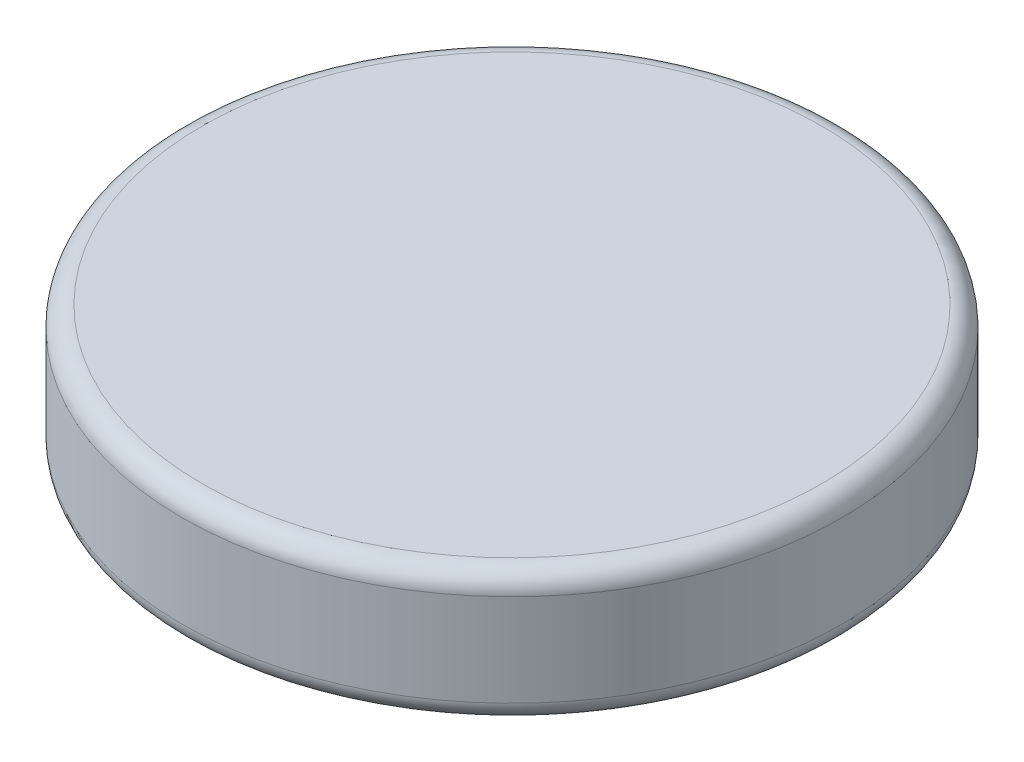
from build123d import *

# Parameters (mm, degrees)
SCHIZZO1_R                   = 5
ESTRUSIONE_ESTRUSIONE1_DEPTH = 2
RACCORDO1_R                  = 0.3
RACCORDO2_R                  = 0.3


with BuildPart() as part:
    # Schizzo1 → Estrusione-Estrusione1 (new body)
    with BuildSketch(Plane(origin=(0, 0, 0), x_dir=(1, 0, 0), z_dir=(0, 1, 0))):
        with Locations(Location((0, 0, 0), (0, 0, 270))):
            Circle(SCHIZZO1_R)
    extrude(amount=ESTRUSIONE_ESTRUSIONE1_DEPTH)

    # Raccordo1
    raccordo1_edges = [part.edges().sort_by_distance(p)[0] for p in [
        (0, 2, -5),
    ]]
    fillet(raccordo1_edges, radius=RACCORDO1_R)

    # Raccordo2
    raccordo2_edges = [part.edges().sort_by_distance(p)[0] for p in [
        (0, 0, -5),
    ]]
    fillet(raccordo2_edges, radius=RACCORDO2_R)


solid = part.part
